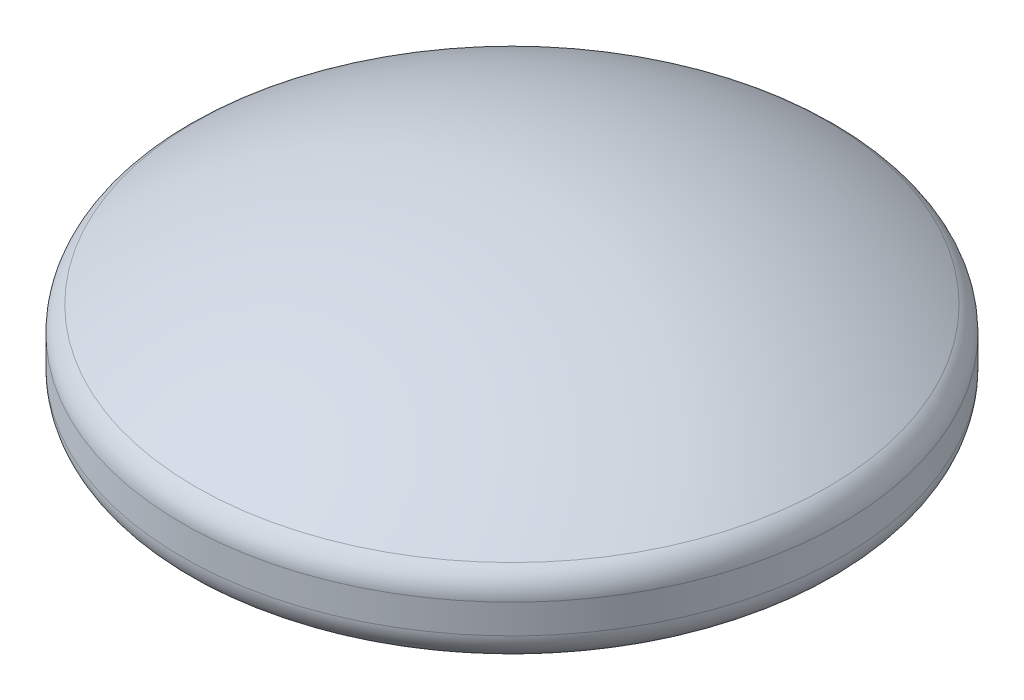
from build123d import *

# Parameters (mm, degrees)
FILLET1_R = 2.54


with BuildPart() as part:
    # Sketch1 → Revolve1 (revolve)
    with BuildSketch(Plane(origin=(0, 0, 0), x_dir=(0, 0, -1), z_dir=(1, 0, 0))):
        with BuildLine():
            Line((0, 3.81), (0, 16.764))
            ThreePointArc((0, 16.764), (14.660113403, 14.487927839), (27.94, 7.874))
            Line((27.94, 7.874), (27.94, 1.524))
            Line((27.94, 1.524), (20.32, 1.524))
            Line((20.32, 1.524), (20.32, 0))
            Line((20.32, 0), (9.906, 0))
            Line((9.906, 0), (9.906, 3.81))
            Line((9.906, 3.81), (0, 3.81))
        make_face()
    revolve(axis=Axis((0, 3.81, 0), (0, 1, 0)))

    # Fillet1
    fillet1_edges = [part.edges().sort_by_distance(p)[0] for p in [
        (0, 7.874, 27.94),
        (0, 1.524, 27.94),
    ]]
    fillet(fillet1_edges, radius=FILLET1_R)


solid = part.part
